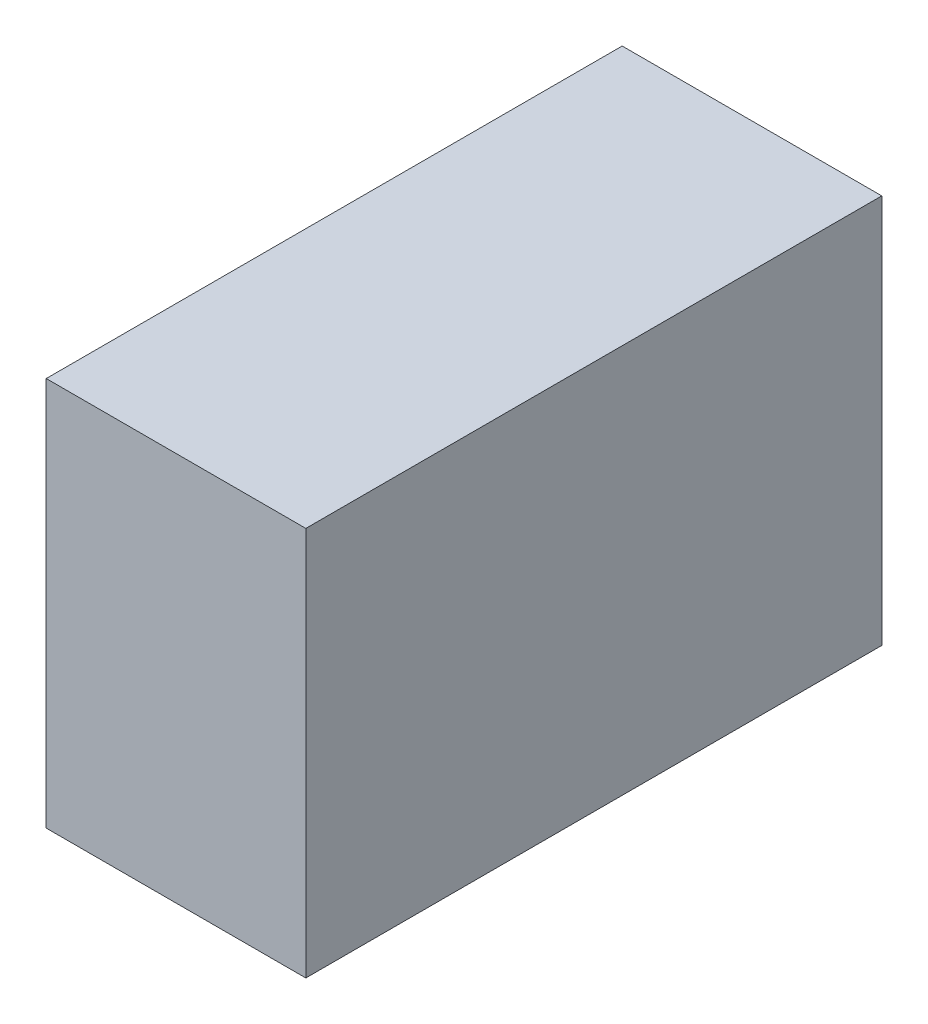
from build123d import *

# Parameters (mm, degrees)
SKETCH1_W           = 50.8
SKETCH1_H           = 112.7125
BOSS_EXTRUDE1_DEPTH = 76.2


with BuildPart() as part:
    # Sketch1 → Boss-Extrude1 (new body)
    with BuildSketch(Plane(origin=(0, 0, 0), x_dir=(1, 0, 0), z_dir=(0, 1, 0))):
        with Locations((25.4, 56.35625)):
            Rectangle(SKETCH1_W, SKETCH1_H)
    extrude(amount=BOSS_EXTRUDE1_DEPTH)


solid = part.part
